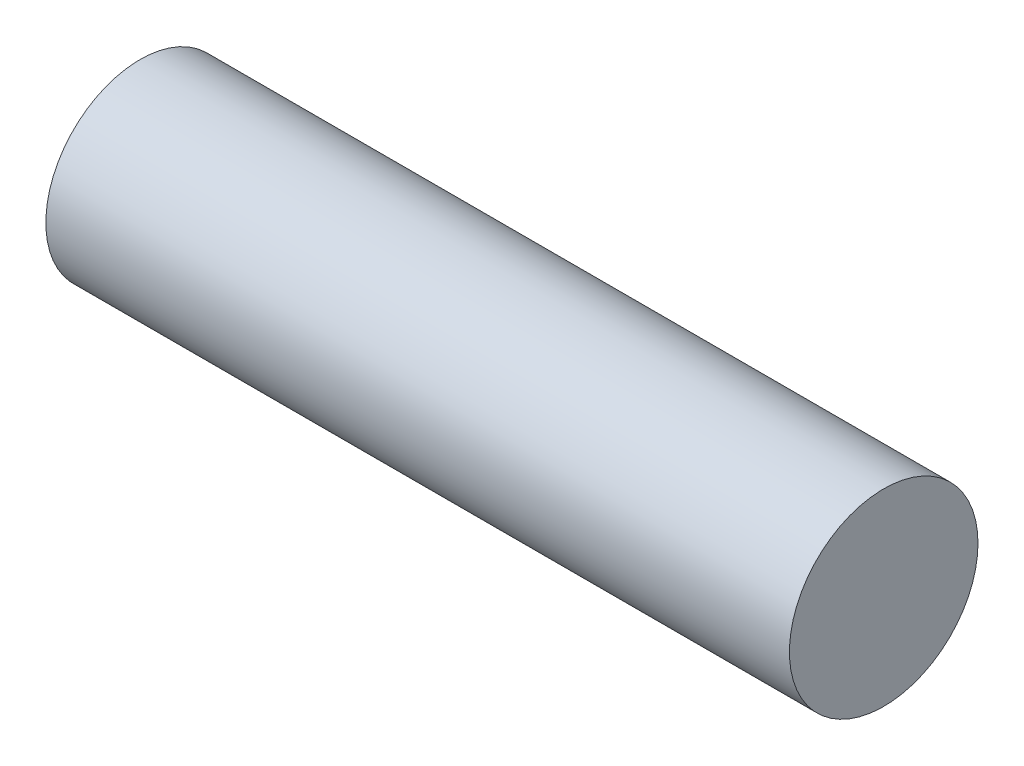
from build123d import *

# Parameters (mm, degrees)
ESBO_O1_R                = 31.699398526
RESSALTO_EXTRUS_O1_DEPTH = 125


with BuildPart() as part:
    # Esboço1 → Ressalto-extrusão1 (new, symmetric)
    with BuildSketch(Plane(origin=(0, 0, 0), x_dir=(0, 0, -1), z_dir=(1, 0, 0))):
        with Locations((-166.503843588, 127.939295123)):
            Circle(ESBO_O1_R)
    extrude(amount=RESSALTO_EXTRUS_O1_DEPTH, both=True)


solid = part.part
